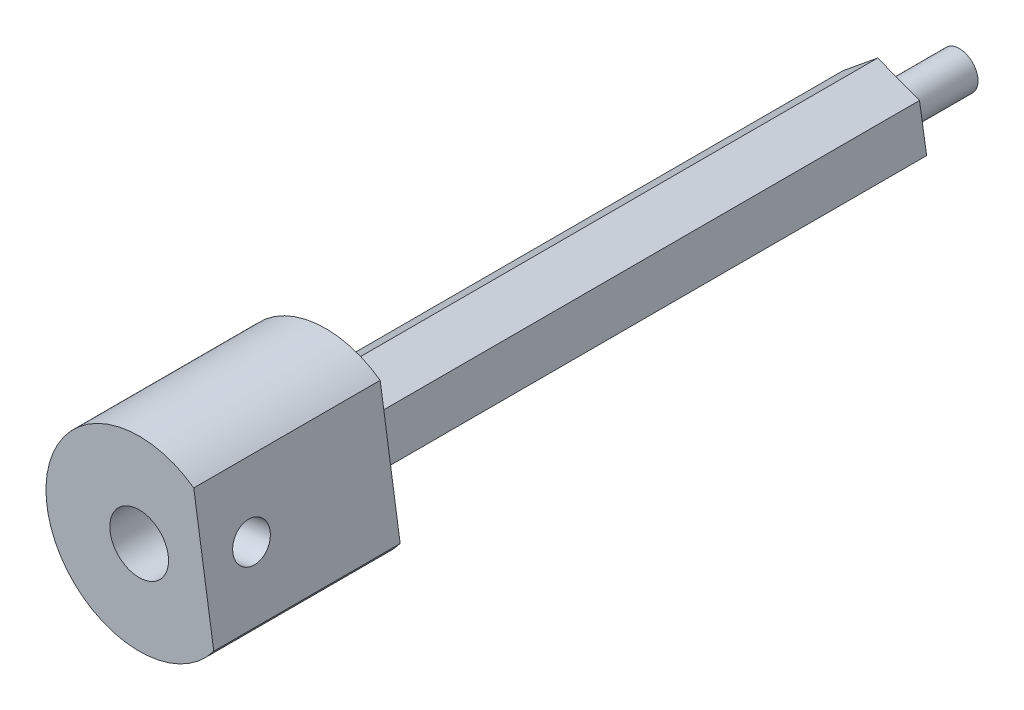
from build123d import *

# Parameters (mm, degrees)
SKETCH1_R           = 6.35
BOSS_EXTRUDE1_DEPTH = 12.7
BOSS_EXTRUDE2_DEPTH = 38.1
SKETCH8_R           = 1.27
BOSS_EXTRUDE3_DEPTH = 5.08
CUT_EXTRUDE1_DEPTH  = 13.97
SKETCH10_R          = 1.27
CUT_EXTRUDE2_DEPTH  = 5.08
SKETCH11_R          = 2
CUT_EXTRUDE3_DEPTH  = 6.35


with BuildPart() as part:
    # Sketch1 → Boss-Extrude1 (new body)
    with BuildSketch(Plane.XY):
        Circle(SKETCH1_R)
    extrude(amount=BOSS_EXTRUDE1_DEPTH)

    # Sketch3 → Boss-Extrude2 (add)
    with BuildSketch(Plane(origin=(0, 0, 0), x_dir=(-1, 0, 0), z_dir=(0, 0, -1))):
        Polygon((0.489155942, 3.00848222), (-2.360844058, 1.927862582), (-2.85, -1.080619638), (-0.489155942, -3.00848222), (2.360844058, -1.927862582), (2.85, 1.080619638), align=None)
    extrude(amount=BOSS_EXTRUDE2_DEPTH)

    # Sketch8 → Boss-Extrude3 (add)
    with BuildSketch(Plane(origin=(0, 0, -38.1), x_dir=(-1, 0, 0), z_dir=(0, 0, -1))):
        Circle(SKETCH8_R)
    extrude(amount=BOSS_EXTRUDE3_DEPTH)

    # Sketch9 → Cut-Extrude1 (cut)
    with BuildSketch(Plane(origin=(0, 0, 0), x_dir=(-1, 0, 0), z_dir=(0, 0, -1))):
        Polygon((-5.082038886, -3.807279968), (-3.718493538, 5.14735911), (-6.16534328, 5.519947057), (-7.528888629, -3.434692022), align=None)
    extrude(amount=-CUT_EXTRUDE1_DEPTH, mode=Mode.SUBTRACT)

    # Sketch10 → Cut-Extrude2 (cut)
    with BuildSketch(Plane(origin=(4.400266212, 0.670039571, 0), x_dir=(0, 0, -1), z_dir=(0.988604335884072, 0.1505372614046529, 0))):
        with Locations(Location((-9.446434999, 0, 0), (0, 0, 90))):
            Circle(SKETCH10_R)
    extrude(amount=-CUT_EXTRUDE2_DEPTH, mode=Mode.SUBTRACT)

    # Sketch11 → Cut-Extrude3 (cut)
    with BuildSketch(Plane.XY.offset(12.7)):
        Circle(SKETCH11_R)
    extrude(amount=-CUT_EXTRUDE3_DEPTH, mode=Mode.SUBTRACT)


solid = part.part
